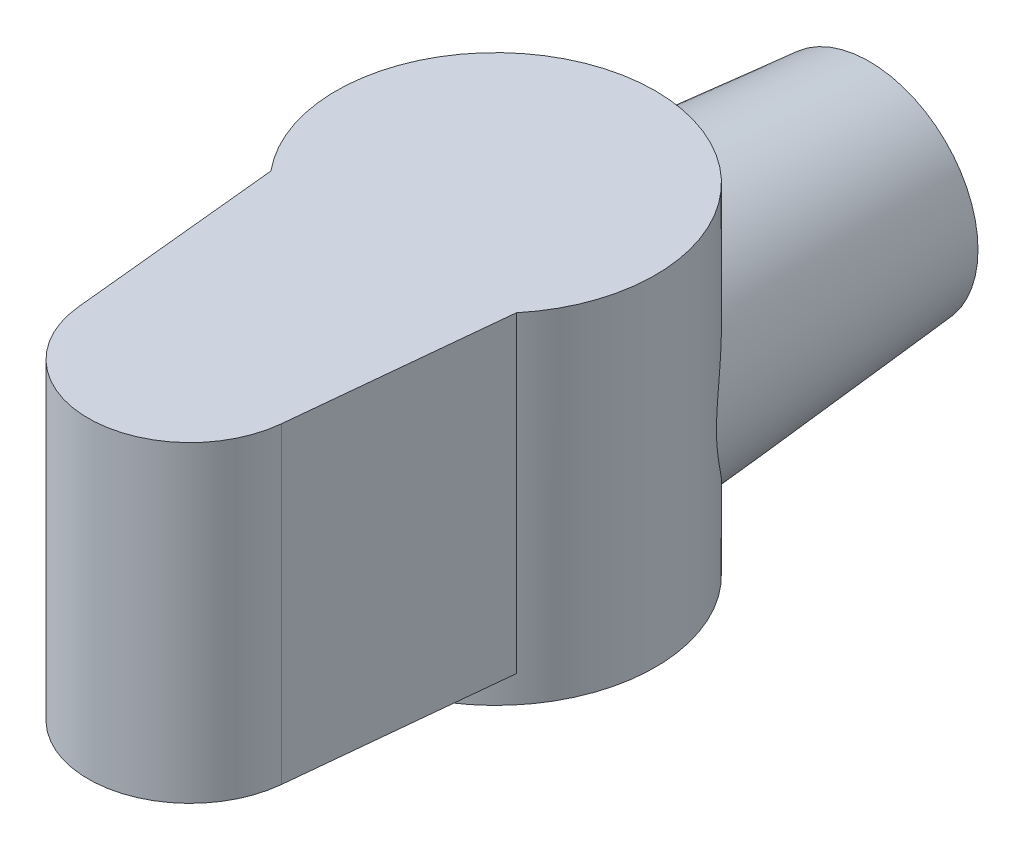
from build123d import *

# Parameters (mm, degrees)
BOSS_EXTRUDE1_DEPTH = 46
SKETCH1_3_R         = 23.5
BOSS_EXTRUDE2_DEPTH = 50


with BuildPart() as part:
    # Sketch1 → Boss-Extrude1 (new body)
    with BuildSketch(Plane(origin=(0, 0, 0), x_dir=(1, 0, 0), z_dir=(0, 1, 0))):
        with BuildLine():
            ThreePointArc((18.072726342, -15.020870899), (0, -23.5), (-18.072726342, -15.020870899))
            Line((-18.072726342, -15.020870899), (-14.925557853, -46.492555785))
            ThreePointArc((-14.925557853, -46.492555785), (0, -60), (14.925557853, -46.492555785))
            Line((14.925557853, -46.492555785), (18.072726342, -15.020870899))
        make_face()
    extrude(amount=-BOSS_EXTRUDE1_DEPTH)

    # Sketch1<3> → Boss-Extrude2 (add)
    with BuildSketch(Plane(origin=(0, 0, 0), x_dir=(1, 0, 0), z_dir=(0, 1, 0))):
        Circle(SKETCH1_3_R)
    extrude(amount=-BOSS_EXTRUDE2_DEPTH)

    # Sketch2 → Revolve1 (revolve)
    with BuildSketch(Plane(origin=(0, -28, 0), x_dir=(1, 0, 0), z_dir=(0, 1, 0))):
        Polygon((-19.721704902, 12.779059268), (0, 12.779059268), (0, 55), (-16, 55), align=None)
    revolve(axis=Axis((0, -28, 0), (0, 0, -1)))


solid = part.part
